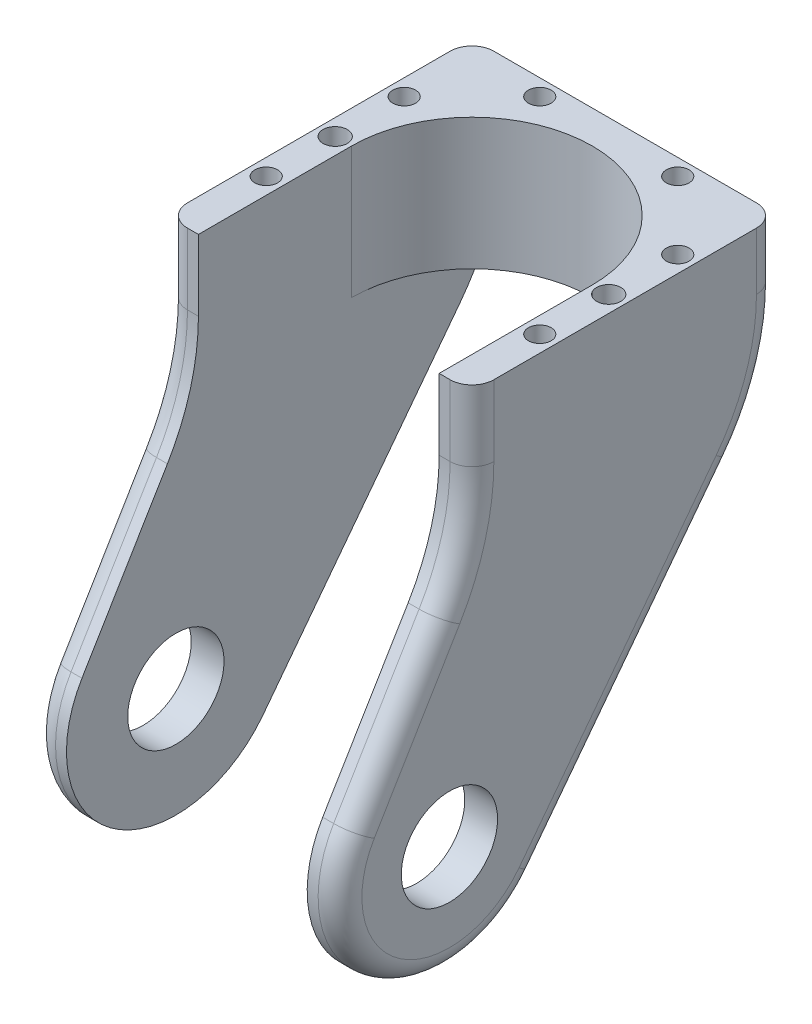
from build123d import *

# Parameters (mm, degrees)
SKETCH1_W               = 70
SKETCH1_H               = 70
SKETCH1_R               = 27.5
BOSS_EXTRUDE1_DEPTH     = 30
SKETCH7_R               = 25
SKETCH7_R_2             = 11
BOSS_EXTRUDE3_DEPTH     = 70
FILLET2_R               = 50
FILLET1_R               = 5
CUT_EXTRUDE10_START     = -30
SKETCH11_W              = 55
SKETCH11_H              = 40.932678931
CUT_EXTRUDE10_DEPTH     = 30
CUT_EXTRUDE8_DEPTH      = 102
CUT_EXTRUDE8_DEPTH_BACK = 102
SKETCH9_W               = 55
SKETCH9_H               = 83.625795222
CUT_EXTRUDE9_DEPTH      = 111.677683924
CUT_EXTRUDE9_DEPTH_BACK = 111.677683924
SKETCH10_R              = 2.6
SKETCH10_R_2            = 2.769242097


with BuildPart() as part:
    # Sketch1 → Boss-Extrude1 (new body)
    with BuildSketch(Plane(origin=(0, 0, 0), x_dir=(1, 0, 0), z_dir=(0, 1, 0))):
        Rectangle(SKETCH1_W, SKETCH1_H)
        with Locations(Location((0, 0, 0), (0, 0, 270))):
            Circle(SKETCH1_R, mode=Mode.SUBTRACT)
    extrude(amount=BOSS_EXTRUDE1_DEPTH)

    # Sketch7 → Boss-Extrude3 (add)
    # profile 1 of 2: a face of its own
    with BuildSketch(Plane(origin=(35, 0, 0), x_dir=(0, 0, -1), z_dir=(1, 0, 0))):
        with BuildLine():
            Line((-35, 0), (-61.608766736, -44.513469812))
            ThreePointArc((-61.608766736, -44.513469812), (-33.496795284, -33.242298709), (-15.150350545, -57.3406431))
            ThreePointArc((-15.150350545, -57.3406431), (-16.464526712, -65.339502354), (-20.268890494, -72.497408793))
            Line((-20.268890494, -72.497408793), (35, 0))
            Line((35, 0), (-35, 0))
        make_face()
    # profile 2 of 2: a face of its own
    with BuildSketch(Plane(origin=(35, 0, 0), x_dir=(0, 0, -1), z_dir=(1, 0, 0))):
        with Locations((-40.150350545, -57.3406431)):
            Circle(SKETCH7_R)
        with Locations((-40.150350545, -57.3406431)):
            Circle(SKETCH7_R_2, mode=Mode.SUBTRACT)
    extrude(amount=-BOSS_EXTRUDE3_DEPTH)

    # Fillet2
    fillet2_edges = [part.edges().sort_by_distance(p)[0] for p in [
        (0, 0, 35),
        (0, 0, -35),
    ]]
    fillet(fillet2_edges, radius=FILLET2_R)

    # Fillet1
    fillet1_edges = [part.edges().sort_by_distance(p)[0] for p in [
        (35, 21.902502464, 35),
        (-35, 21.902502464, 35),
        (-35, 23.442665232, -35),
        (35, 23.442665232, -35),
        (35, -28.181405731, 51.845967177),
        (-35, -78.043374613, 54.164518657),
        (-35, -28.181405731, 51.845967177),
        (35, -78.043374613, 54.164518657),
        (35, -42.962804857, -2.247014803),
        (-35, -42.962804857, -2.247014803),
        (35, 0.887611955, -32.371647665),
        (-35, 0.887611955, -32.371647665),
        (35, 0.497894405, 36.803311218),
        (-35, 0.497894405, 36.803311218),
    ]]
    fillet(fillet1_edges, radius=FILLET1_R)

    # Sketch11 → Cut-Extrude10 (cut)
    with BuildSketch(Plane(origin=(0, 30, 0), x_dir=(1, 0, 0), z_dir=(0, 1, 0)).offset(CUT_EXTRUDE10_START)):
        with BuildLine():
            ThreePointArc((27.5, 0), (0, -27.5), (-27.5, 0))
            Line((-27.5, 0), (-27.5, -35))
            Line((-27.5, -35), (27.5, -35))
            Line((27.5, -35), (27.5, 0))
        make_face()
        with Locations((0, -55.466339465)):
            Rectangle(SKETCH11_W, SKETCH11_H)
    extrude(amount=CUT_EXTRUDE10_DEPTH, mode=Mode.SUBTRACT)

    # Sketch9 → Cut-Extrude8 (cut, two sides: drawn at the far end of the back side and taken through both)
    with BuildSketch(Plane.XY.offset(-CUT_EXTRUDE8_DEPTH_BACK)):
        with Locations((0, -41.812897611)):
            Rectangle(SKETCH9_W, SKETCH9_H)
    extrude(amount=CUT_EXTRUDE8_DEPTH + CUT_EXTRUDE8_DEPTH_BACK, mode=Mode.SUBTRACT)

    # Sketch10 → Cut-Extrude9 (cut, two sides: drawn at the far end of the back side and taken through both)
    with BuildSketch(Plane(origin=(0, 0, 0), x_dir=(-1, 0, 0), z_dir=(0, -1, 0)).offset(-CUT_EXTRUDE9_DEPTH_BACK)):
        with Locations(Location((-15.761900266, 31.25, 0), (0, 0, 90))):
            Circle(SKETCH10_R)
        with Locations(Location((15.761900266, 31.25, 0), (0, 0, 90))):
            Circle(SKETCH10_R)
        with Locations(Location((-31.25, -15.761900266, 0), (0, 0, 90))):
            Circle(SKETCH10_R)
        with Locations(Location((-31.25, 15.761900266, 0), (0, 0, 90))):
            Circle(SKETCH10_R)
        with Locations(Location((31.25, 15.761900266, 0), (0, 0, 90))):
            Circle(SKETCH10_R)
        with Locations(Location((31.25, -15.761900266, 0), (0, 0, 90))):
            Circle(SKETCH10_R)
        with Locations(Location((-31.25, 0, 0), (0, 0, 90))):
            Circle(SKETCH10_R_2)
        with Locations(Location((31.25, 0, 0), (0, 0, 90))):
            Circle(SKETCH10_R_2)
        with Locations((-20.72890494, -31.25)):
            Circle(SKETCH10_R_2)
        with Locations((15.761900266, -31.25)):
            Circle(SKETCH10_R_2)
    extrude(amount=CUT_EXTRUDE9_DEPTH + CUT_EXTRUDE9_DEPTH_BACK, mode=Mode.SUBTRACT)


solid = part.part
